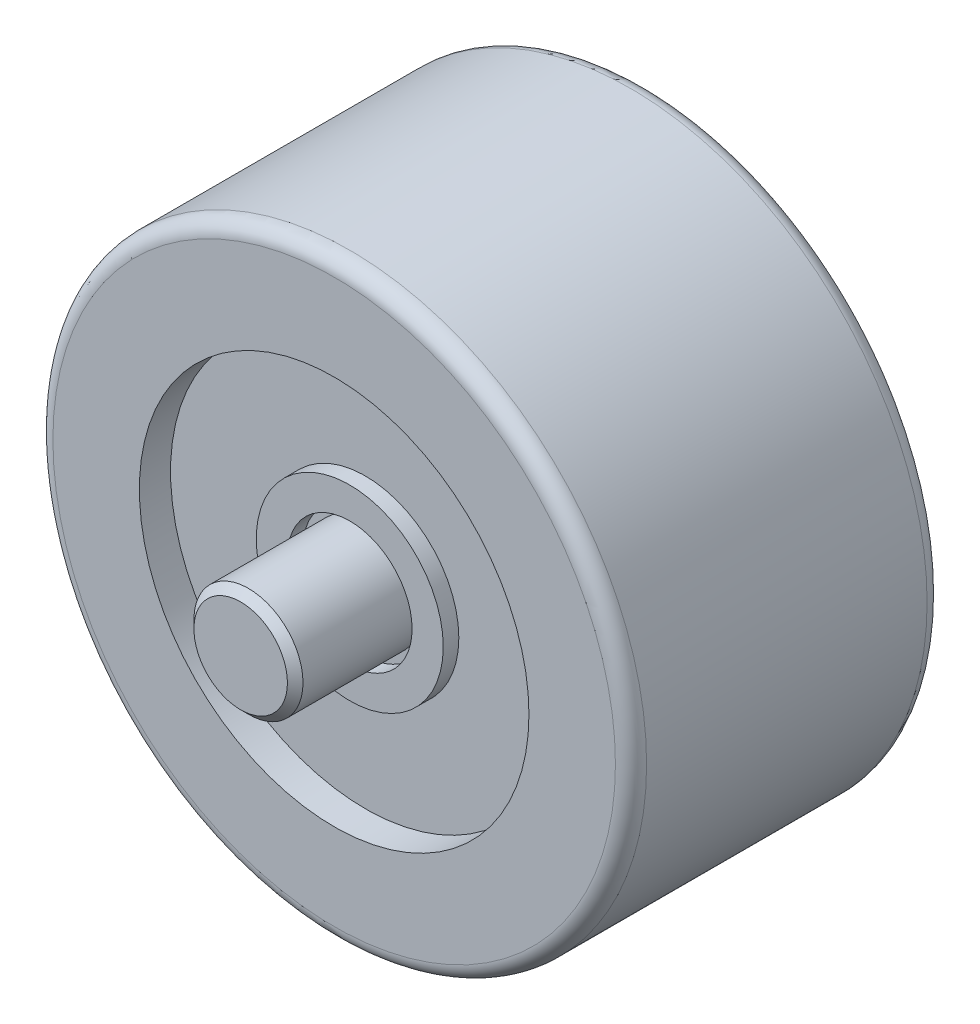
from build123d import *

# Parameters (mm, degrees)
BOSS_EXTRUDE1_DEPTH      = 10
BOSS_EXTRUDE1_DEPTH_BACK = 10
SKETCH1_R                = 19.05
FILLET1_R                = 1
SKETCH2_R                = 12.5
CUT_EXTRUDE1_DEPTH       = 2
CUT_EXTRUDE2_START       = -2
SKETCH3_R                = 12.5
CUT_EXTRUDE2_DEPTH       = 2
SKETCH4_R                = 6
SKETCH4_R_2              = 4
BOSS_EXTRUDE2_DEPTH      = 1
SKETCH5_R                = 3.5
BOSS_EXTRUDE3_DEPTH      = 8
CHAMFER1_SIZE            = 0.5


with BuildPart() as part:
    # Sketch1 → Boss-Extrude1 (new, two sides: drawn at the far end of the back side and taken through both)
    with BuildSketch(Plane.XY.offset(-BOSS_EXTRUDE1_DEPTH_BACK)):
        Circle(SKETCH1_R)
    extrude(amount=BOSS_EXTRUDE1_DEPTH + BOSS_EXTRUDE1_DEPTH_BACK)

    # Fillet1
    fillet1_edges = [part.edges().sort_by_distance(p)[0] for p in [
        (-19.05, 0, -10),
        (-19.05, 0, 10),
    ]]
    fillet(fillet1_edges, radius=FILLET1_R)

    # Sketch2 → Cut-Extrude1 (cut)
    with BuildSketch(Plane.XY.offset(10)):
        Circle(SKETCH2_R)
    extrude(amount=-CUT_EXTRUDE1_DEPTH, mode=Mode.SUBTRACT)

    # Sketch3 → Cut-Extrude2 (cut)
    with BuildSketch(Plane(origin=(0, 0, -10), x_dir=(-1, 0, 0), z_dir=(0, 0, -1)).offset(CUT_EXTRUDE2_START)):
        Circle(SKETCH3_R)
    extrude(amount=CUT_EXTRUDE2_DEPTH, mode=Mode.SUBTRACT)

    # Sketch4 → Boss-Extrude2 (add)
    with BuildSketch(Plane.XY.offset(8)):
        Circle(SKETCH4_R)
        Circle(SKETCH4_R_2, mode=Mode.SUBTRACT)
    boss_extrude2 = extrude(amount=BOSS_EXTRUDE2_DEPTH)

    # Mirror1: Boss-Extrude2 across plane
    add(boss_extrude2.mirror(Plane.XY))

    # Sketch5 → Boss-Extrude3 (add)
    with BuildSketch(Plane.XY.offset(8)):
        Circle(SKETCH5_R)
    boss_extrude3 = extrude(amount=BOSS_EXTRUDE3_DEPTH)

    # Mirror2: Boss-Extrude3 across plane
    add(boss_extrude3.mirror(Plane.XY))

    # Chamfer1
    chamfer1_edges = [part.edges().sort_by_distance(p)[0] for p in [
        (-3.5, 0, -16),
        (-3.5, 0, 16),
    ]]
    chamfer(chamfer1_edges, length=CHAMFER1_SIZE)


solid = part.part
